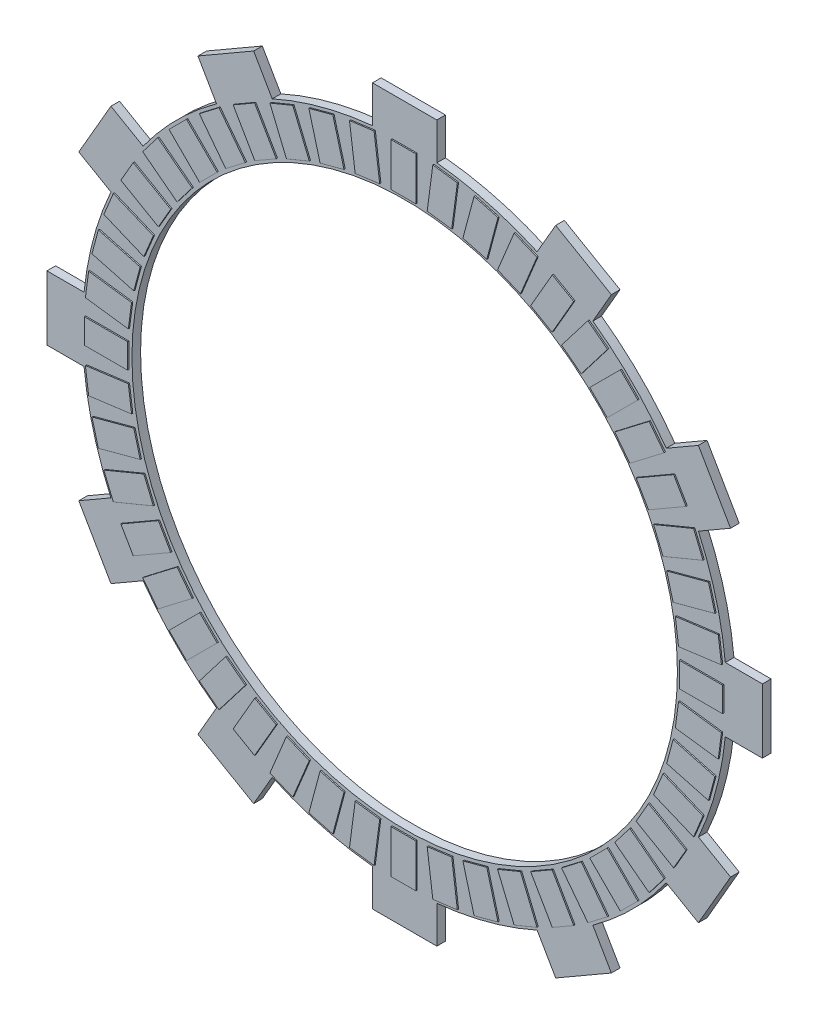
from build123d import *

# Parameters (mm, degrees)
SKETCH1_R                = 56.007
BOSS_EXTRUDE1_DEPTH      = 1.778
BOSS_EXTRUDE2_DEPTH      = 0.254
BOSS_EXTRUDE2_DEPTH_BACK = 2.032
SKETCH2_W                = 5.08
SKETCH2_H                = 8.89
SKETCH2_W_2              = 8.89
SKETCH2_H_2              = 5.08


with BuildPart() as part:
    # Sketch1 → Boss-Extrude1 (new body)
    with BuildSketch(Plane.XY):
        with BuildLine():
            Line((-6.604, 65.836608912), (-6.604, 73.456608912))
            Line((-6.604, 73.456608912), (6.604, 73.456608912))
            Line((6.604, 73.456608912), (6.604, 65.836608912))
            ThreePointArc((6.604, 65.836608912), (17.125279757, 63.912414148), (27.199072689, 60.318175817))
            Line((27.199072689, 60.318175817), (31.009072689, 66.917289393))
            Line((31.009072689, 66.917289393), (42.447536222, 60.313289393))
            Line((42.447536222, 60.313289393), (38.637536222, 53.714175817))
            ThreePointArc((38.637536222, 53.714175817), (46.787134391, 46.787134391), (53.714175817, 38.637536222))
            Line((53.714175817, 38.637536222), (60.313289393, 42.447536222))
            Line((60.313289393, 42.447536222), (66.917289393, 31.009072689))
            Line((66.917289393, 31.009072689), (60.318175817, 27.199072689))
            ThreePointArc((60.318175817, 27.199072689), (63.912414148, 17.125279757), (65.836608912, 6.604))
            Line((65.836608912, 6.604), (73.456608912, 6.604))
            Line((73.456608912, 6.604), (73.456608912, -6.604))
            Line((73.456608912, -6.604), (65.836608912, -6.604))
            ThreePointArc((65.836608912, -6.604), (63.912414148, -17.125279757), (60.318175817, -27.199072689))
            Line((60.318175817, -27.199072689), (66.917289393, -31.009072689))
            Line((66.917289393, -31.009072689), (60.313289393, -42.447536222))
            Line((60.313289393, -42.447536222), (53.714175817, -38.637536222))
            ThreePointArc((53.714175817, -38.637536222), (46.787134391, -46.787134391), (38.637536222, -53.714175817))
            Line((38.637536222, -53.714175817), (42.447536222, -60.313289393))
            Line((42.447536222, -60.313289393), (31.009072689, -66.917289393))
            Line((31.009072689, -66.917289393), (27.199072689, -60.318175817))
            ThreePointArc((27.199072689, -60.318175817), (17.125279757, -63.912414148), (6.604, -65.836608912))
            Line((6.604, -65.836608912), (6.604, -73.456608912))
            Line((6.604, -73.456608912), (-6.604, -73.456608912))
            Line((-6.604, -73.456608912), (-6.604, -65.836608912))
            ThreePointArc((-6.604, -65.836608912), (-17.125279757, -63.912414148), (-27.199072689, -60.318175817))
            Line((-27.199072689, -60.318175817), (-31.009072689, -66.917289393))
            Line((-31.009072689, -66.917289393), (-42.447536222, -60.313289393))
            Line((-42.447536222, -60.313289393), (-38.637536222, -53.714175817))
            ThreePointArc((-38.637536222, -53.714175817), (-46.787134391, -46.787134391), (-53.714175817, -38.637536222))
            Line((-53.714175817, -38.637536222), (-60.313289393, -42.447536222))
            Line((-60.313289393, -42.447536222), (-66.917289393, -31.009072689))
            Line((-66.917289393, -31.009072689), (-60.318175817, -27.199072689))
            ThreePointArc((-60.318175817, -27.199072689), (-63.912414148, -17.125279757), (-65.836608912, -6.604))
            Line((-65.836608912, -6.604), (-73.456608912, -6.604))
            Line((-73.456608912, -6.604), (-73.456608912, 6.604))
            Line((-73.456608912, 6.604), (-65.836608912, 6.604))
            ThreePointArc((-65.836608912, 6.604), (-63.912414148, 17.125279757), (-60.318175817, 27.199072689))
            Line((-60.318175817, 27.199072689), (-66.917289393, 31.009072689))
            Line((-66.917289393, 31.009072689), (-60.313289393, 42.447536222))
            Line((-60.313289393, 42.447536222), (-53.714175817, 38.637536222))
            ThreePointArc((-53.714175817, 38.637536222), (-46.787134391, 46.787134391), (-38.637536222, 53.714175817))
            Line((-38.637536222, 53.714175817), (-42.447536222, 60.313289393))
            Line((-42.447536222, 60.313289393), (-31.009072689, 66.917289393))
            Line((-31.009072689, 66.917289393), (-27.199072689, 60.318175817))
            ThreePointArc((-27.199072689, 60.318175817), (-17.125279757, 63.912414148), (-6.604, 65.836608912))
        make_face()
        Circle(SKETCH1_R, mode=Mode.SUBTRACT)
    extrude(amount=BOSS_EXTRUDE1_DEPTH)

    # Sketch2 → Boss-Extrude2 (add, two sides: drawn at the far end of the back side and taken through both)
    with BuildSketch(Plane.XY.offset(1.778).offset(-BOSS_EXTRUDE2_DEPTH_BACK)):
        with Locations((0, 61.087)):
            Rectangle(SKETCH2_W, SKETCH2_H)
        Polygon((4.874994632, 56.488956366), (6.035372481, 65.302901184), (11.071912376, 64.639828127), (9.911534528, 55.82588331), align=None)
        Polygon((12.206576754, 55.369371027), (14.507478065, 63.956451623), (19.414381262, 62.641650874), (17.113479951, 54.054570278), align=None)
        Polygon((19.329300963, 53.302400399), (22.731356677, 61.515689443), (27.424664702, 59.571657606), (24.022608989, 51.358368562), align=None)
        Polygon((26.121295474, 50.323410921), (30.566295474, 58.022376761), (34.965704526, 55.482376761), (30.520704526, 47.783410921), align=None)
        Polygon((32.466347378, 46.48337393), (37.878236481, 53.536285126), (41.90847145, 50.443777066), (36.496582346, 43.390865871), align=None)
        Polygon((38.255891076, 41.847993524), (44.542070361, 48.134172809), (48.134172809, 44.542070361), (41.847993524, 38.255891076), align=None)
        Polygon((43.390865871, 36.496582346), (50.443777066, 41.90847145), (53.536285126, 37.878236481), (46.48337393, 32.466347378), align=None)
        Polygon((47.783410921, 30.520704526), (55.482376761, 34.965704526), (58.022376761, 30.566295474), (50.323410921, 26.121295474), align=None)
        Polygon((51.358368562, 24.022608989), (59.571657606, 27.424664702), (61.515689443, 22.731356677), (53.302400399, 19.329300963), align=None)
        Polygon((54.054570278, 17.113479951), (62.641650874, 19.414381262), (63.956451623, 14.507478065), (55.369371027, 12.206576754), align=None)
        Polygon((55.82588331, 9.911534528), (64.639828127, 11.071912376), (65.302901184, 6.035372481), (56.488956366, 4.874994632), align=None)
        with Locations((61.087, 0)):
            Rectangle(SKETCH2_W_2, SKETCH2_H_2)
        Polygon((56.488956366, -4.874994632), (65.302901184, -6.035372481), (64.639828127, -11.071912376), (55.82588331, -9.911534528), align=None)
        Polygon((55.369371027, -12.206576754), (63.956451623, -14.507478065), (62.641650874, -19.414381262), (54.054570278, -17.113479951), align=None)
        Polygon((53.302400399, -19.329300963), (61.515689443, -22.731356677), (59.571657606, -27.424664702), (51.358368562, -24.022608989), align=None)
        Polygon((50.323410921, -26.121295474), (58.022376761, -30.566295474), (55.482376761, -34.965704526), (47.783410921, -30.520704526), align=None)
        Polygon((46.48337393, -32.466347378), (53.536285126, -37.878236481), (50.443777066, -41.90847145), (43.390865871, -36.496582346), align=None)
        Polygon((41.847993524, -38.255891076), (48.134172809, -44.542070361), (44.542070361, -48.134172809), (38.255891076, -41.847993524), align=None)
        Polygon((36.496582346, -43.390865871), (41.90847145, -50.443777066), (37.878236481, -53.536285126), (32.466347378, -46.48337393), align=None)
        Polygon((30.520704526, -47.783410921), (34.965704526, -55.482376761), (30.566295474, -58.022376761), (26.121295474, -50.323410921), align=None)
        Polygon((24.022608989, -51.358368562), (27.424664702, -59.571657606), (22.731356677, -61.515689443), (19.329300963, -53.302400399), align=None)
        Polygon((17.113479951, -54.054570278), (19.414381262, -62.641650874), (14.507478065, -63.956451623), (12.206576754, -55.369371027), align=None)
        Polygon((9.911534528, -55.82588331), (11.071912376, -64.639828127), (6.035372481, -65.302901184), (4.874994632, -56.488956366), align=None)
        with Locations((0, -61.087)):
            Rectangle(SKETCH2_W, SKETCH2_H)
        Polygon((-4.874994632, -56.488956366), (-6.035372481, -65.302901184), (-11.071912376, -64.639828127), (-9.911534528, -55.82588331), align=None)
        Polygon((-12.206576754, -55.369371027), (-14.507478065, -63.956451623), (-19.414381262, -62.641650874), (-17.113479951, -54.054570278), align=None)
        Polygon((-19.329300963, -53.302400399), (-22.731356677, -61.515689443), (-27.424664702, -59.571657606), (-24.022608989, -51.358368562), align=None)
        Polygon((-26.121295474, -50.323410921), (-30.566295474, -58.022376761), (-34.965704526, -55.482376761), (-30.520704526, -47.783410921), align=None)
        Polygon((-32.466347378, -46.48337393), (-37.878236481, -53.536285126), (-41.90847145, -50.443777066), (-36.496582346, -43.390865871), align=None)
        Polygon((-38.255891076, -41.847993524), (-44.54207036, -48.134172809), (-48.134172809, -44.542070361), (-41.847993524, -38.255891076), align=None)
        Polygon((-43.390865871, -36.496582346), (-50.443777066, -41.90847145), (-53.536285126, -37.878236481), (-46.48337393, -32.466347378), align=None)
        Polygon((-47.783410921, -30.520704526), (-55.482376761, -34.965704526), (-58.022376761, -30.566295474), (-50.323410921, -26.121295474), align=None)
        Polygon((-51.358368562, -24.022608989), (-59.571657606, -27.424664702), (-61.515689443, -22.731356677), (-53.302400399, -19.329300963), align=None)
        Polygon((-54.054570278, -17.113479951), (-62.641650874, -19.414381262), (-63.956451623, -14.507478065), (-55.369371027, -12.206576754), align=None)
        Polygon((-55.82588331, -9.911534528), (-64.639828127, -11.071912376), (-65.302901184, -6.035372481), (-56.488956366, -4.874994632), align=None)
        with Locations((-61.087, 0)):
            Rectangle(SKETCH2_W_2, SKETCH2_H_2)
        Polygon((-56.488956366, 4.874994632), (-65.302901184, 6.035372481), (-64.639828127, 11.071912376), (-55.82588331, 9.911534528), align=None)
        Polygon((-55.369371027, 12.206576754), (-63.956451623, 14.507478065), (-62.641650874, 19.414381262), (-54.054570278, 17.113479951), align=None)
        Polygon((-53.302400399, 19.329300963), (-61.515689443, 22.731356677), (-59.571657606, 27.424664702), (-51.358368562, 24.022608989), align=None)
        Polygon((-50.323410921, 26.121295474), (-58.022376761, 30.566295474), (-55.482376761, 34.965704526), (-47.783410921, 30.520704526), align=None)
        Polygon((-46.48337393, 32.466347378), (-53.536285126, 37.878236481), (-50.443777066, 41.90847145), (-43.390865871, 36.496582346), align=None)
        Polygon((-41.847993524, 38.255891076), (-48.134172809, 44.542070361), (-44.542070361, 48.134172809), (-38.255891076, 41.847993524), align=None)
        Polygon((-36.496582346, 43.390865871), (-41.90847145, 50.443777066), (-37.878236481, 53.536285126), (-32.466347378, 46.48337393), align=None)
        Polygon((-30.520704526, 47.783410921), (-34.965704526, 55.482376761), (-30.566295474, 58.022376761), (-26.121295474, 50.323410921), align=None)
        Polygon((-24.022608989, 51.358368562), (-27.424664702, 59.571657606), (-22.731356677, 61.515689443), (-19.329300963, 53.302400399), align=None)
        Polygon((-17.113479951, 54.054570278), (-19.414381262, 62.641650874), (-14.507478065, 63.956451623), (-12.206576754, 55.369371027), align=None)
        Polygon((-9.911534528, 55.82588331), (-11.071912376, 64.639828127), (-6.035372481, 65.302901184), (-4.874994632, 56.488956366), align=None)
    extrude(amount=BOSS_EXTRUDE2_DEPTH + BOSS_EXTRUDE2_DEPTH_BACK)


solid = part.part
